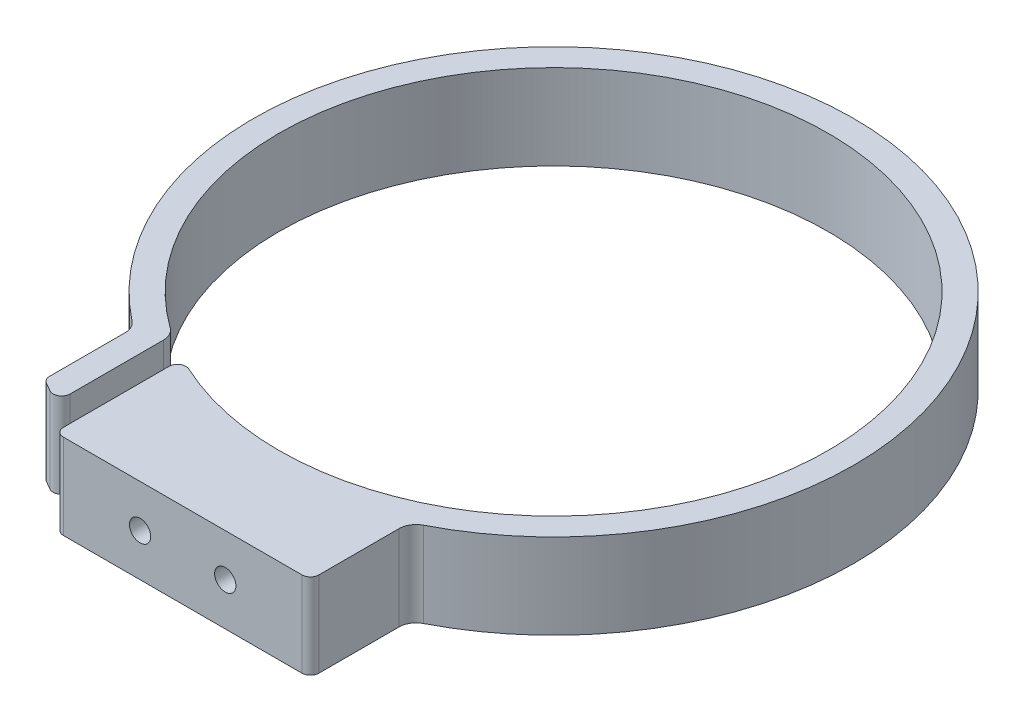
from build123d import *

# Parameters (mm, degrees)
SKETCH_1_R            = 32.25
EXTRUDE_1_DEPTH       = 10
SKETCH_4_W            = 3
SKETCH_4_H            = 8.186725545
CUT_EXTRUDE_2_DEPTH   = 10
EXTRUDE_5_DEPTH       = 10
HOLE_WIZARD_M32_D     = 3.4
HOLE_WIZARD_M32_DEPTH = 3
M3X0_51_D             = 2.5
M3X0_51_DEPTH         = 8.5
M3X0_51_TIP           = 0.751075774
M3X0_52_D             = 2.5
M3X0_52_DEPTH         = 8.5
M3X0_52_TIP           = 0.751075774
FILLET_1_R            = 2
FILLET_2_R            = 1


with BuildPart() as part:
    # Эскиз1 → Бобышка-Вытянуть1 (new body)
    with BuildSketch(Plane(origin=(0, 0, 0), x_dir=(1, 0, 0), z_dir=(0, 1, 0))):
        with BuildLine():
            Line((-15, -31.899255477), (-15, -43.549299466))
            Line((-15, -43.549299466), (15, -43.549299466))
            Line((15, -43.549299466), (15, -31.899255477))
            ThreePointArc((15, -31.899255477), (0, 35.25), (-15, -31.899255477))
        make_face()
        with Locations(Location((0, 0, 0), (0, 0, 270))):
            Circle(SKETCH_1_R, mode=Mode.SUBTRACT)
    extrude(amount=EXTRUDE_1_DEPTH)

    # Эскиз4 → Вырез-Вытянуть2 (cut)
    with BuildSketch(Plane(origin=(0, 10, 0), x_dir=(1, 0, 0), z_dir=(0, 1, 0))):
        with Locations((-16.5, -27.805892705)):
            Rectangle(SKETCH_4_W, SKETCH_4_H)
    extrude(amount=-CUT_EXTRUDE_2_DEPTH, mode=Mode.SUBTRACT)

    # Эскиз11 → Бобышка-Вытянуть5 (add)
    with BuildSketch(Plane(origin=(0, 10, 0), x_dir=(1, 0, 0), z_dir=(0, 1, 0))):
        Polygon((-18, -26.759344162), (-21, -26.759344162), (-21, -38.759344162), (-18, -40.49139497), align=None)
    extrude(amount=-EXTRUDE_5_DEPTH)

    # Отверстие с зазором M32
    with Locations(Plane.ZY.offset(21)):
        with Locations((33.759344162, 5)):
            Hole(HOLE_WIZARD_M32_D / 2, depth=HOLE_WIZARD_M32_DEPTH)

    # Отверстие обработанное метчиком M3x0.51
    with Locations(Plane.ZY.offset(15)):
        with Locations((33.759344162, 5)):
            Hole(M3X0_51_D / 2, depth=M3X0_51_DEPTH)
            with Locations((0, 0, -(M3X0_51_DEPTH + M3X0_51_TIP / 2))):  # 118° drill point
                Cone(0, M3X0_51_D / 2, M3X0_51_TIP, mode=Mode.SUBTRACT)

    # Отверстие обработанное метчиком M3x0.52
    with Locations(Plane.XY.offset(43.549299466)):
        with Locations((-5, 5), (5, 5)):
            Hole(M3X0_52_D / 2, depth=M3X0_52_DEPTH)
            with Locations((0, 0, -(M3X0_52_DEPTH + M3X0_52_TIP / 2))):  # 118° drill point
                Cone(0, M3X0_52_D / 2, M3X0_52_TIP, mode=Mode.SUBTRACT)

    # Скругление1
    fillet_1_edges = [part.edges().sort_by_distance(p)[0] for p in [
        (-18, 5, 26.759344162),
        (-21, 5, 28.311879132),
        (15, 5, 31.899255477),
    ]]
    fillet(fillet_1_edges, radius=FILLET_1_R)

    # Скругление2
    fillet_2_edges = [part.edges().sort_by_distance(p)[0] for p in [
        (-15, 5, 28.549299466),
        (-21, 5, 38.759344162),
        (-18, 5, 40.49139497),
        (-15, 5, 43.549299466),
        (15, 5, 43.549299466),
    ]]
    fillet(fillet_2_edges, radius=FILLET_2_R)


solid = part.part
